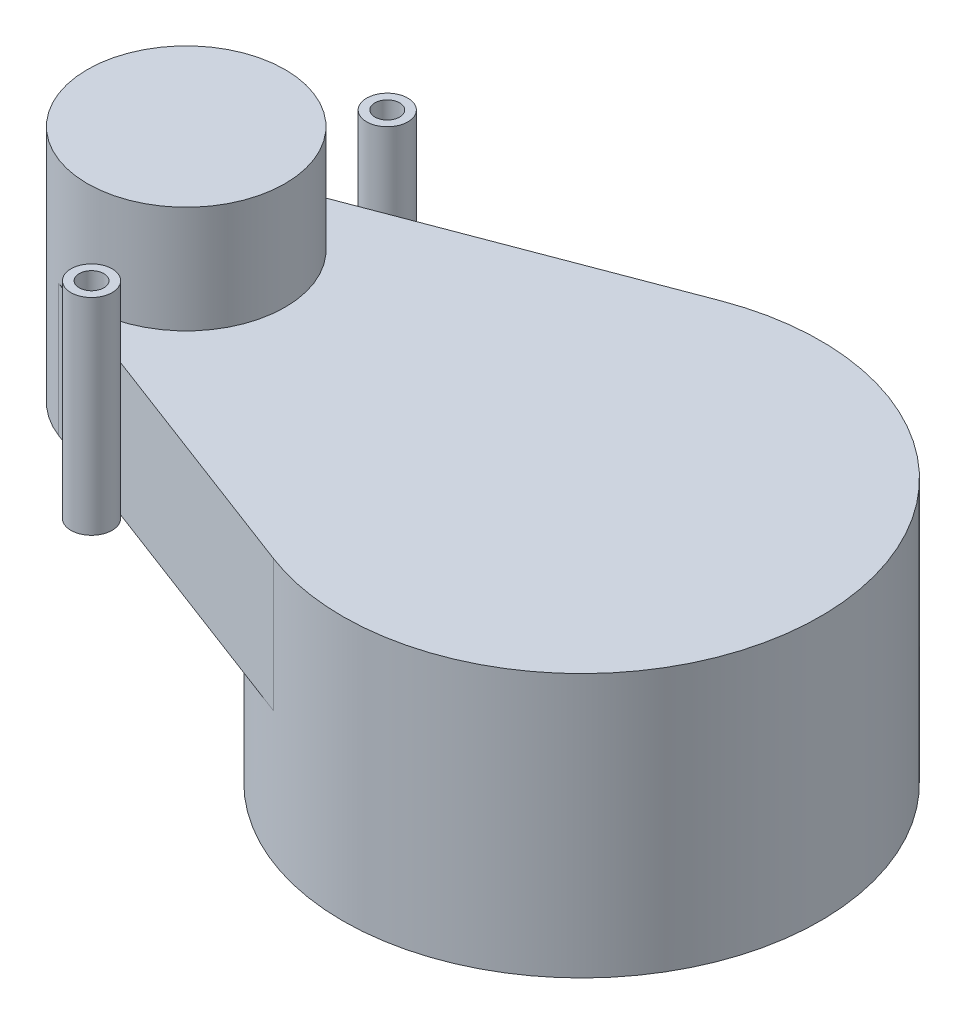
from build123d import *

# Parameters (mm, degrees)
SKETCH_1_R        = 29
EXTRUDE_1_DEPTH   = 16
EXTRUDE_START     = 16
EXTRUDE_2_DEPTH   = 16
EXTRUDE_START_2   = 13
EXTRUDE_3_DEPTH   = 13
EXTRUDE_START_3   = -16
SKETCH_4_R        = 2.5
SKETCH_4_R_2      = 1.5
EXTRUDE_4_DEPTH   = 25
EXTRUDE_4_2_DEPTH = 25


with BuildPart() as part:
    # 草图1 → 凸台-拉伸1 (new body)
    with BuildSketch(Plane(origin=(0, 0, 0), x_dir=(1, 0, 0), z_dir=(0, 1, 0))):
        with Locations(Location((0, 0, 0), (0, 0, 270))):
            Circle(SKETCH_1_R)
    extrude(amount=-EXTRUDE_1_DEPTH)

    # 草图2 → 凸台-拉伸2 (add)
    with BuildSketch(Plane(origin=(0, 0, 0), x_dir=(1, 0, 0), z_dir=(0, 1, 0)).offset(EXTRUDE_START)):
        with BuildLine():
            Line((-10.270833333, 27.120287289), (-52.25, 11.222187844))
            ThreePointArc((-52.25, 11.222187844), (-60, 0), (-52.25, -11.222187844))
            Line((-52.25, -11.222187844), (-10.270833333, -27.120287289))
            ThreePointArc((-10.270833333, -27.120287289), (29, 0), (-10.270833333, 27.120287289))
        make_face()
    extrude(amount=-EXTRUDE_2_DEPTH)

    # 草图3 → 凸台-拉伸3 (add)
    with BuildSketch(Plane(origin=(0, 16, 0), x_dir=(1, 0, 0), z_dir=(0, 1, 0)).offset(EXTRUDE_START_2)):
        with BuildLine():
            ThreePointArc((-36, 0), (-41.180909152, 9.874208829), (-52.25, 11.222187844))
            ThreePointArc((-52.25, 11.222187844), (-60, 0), (-52.25, -11.222187844))
            ThreePointArc((-52.25, -11.222187844), (-41.180909152, -9.874208829), (-36, 0))
        make_face()
    extrude(amount=-EXTRUDE_3_DEPTH)


with BuildPart() as body_2:
    # 草图4 → 凸台-拉伸4 (new body)
    with BuildSketch(Plane(origin=(0, 16, 0), x_dir=(1, 0, 0), z_dir=(0, 1, 0)).offset(EXTRUDE_START_3)):
        with Locations(Location((-41.543936048, -17.95, 0), (0, 0, 270))):
            Circle(SKETCH_4_R)
        with Locations(Location((-41.543936048, -17.95, 0), (0, 0, 270))):
            Circle(SKETCH_4_R_2, mode=Mode.SUBTRACT)
    extrude(amount=EXTRUDE_4_DEPTH)


with BuildPart() as body_3:
    # 草图4 → Extrude 4 2 (new body)
    with BuildSketch(Plane(origin=(0, 16, 0), x_dir=(1, 0, 0), z_dir=(0, 1, 0)).offset(EXTRUDE_START_3)):
        with Locations(Location((-41.543936048, 17.95, 0), (0, 0, 270))):
            Circle(SKETCH_4_R)
        with Locations(Location((-41.543936048, 17.95, 0), (0, 0, 270))):
            Circle(SKETCH_4_R_2, mode=Mode.SUBTRACT)
    extrude(amount=EXTRUDE_4_2_DEPTH)


solid = Compound([part.part, body_2.part, body_3.part])
